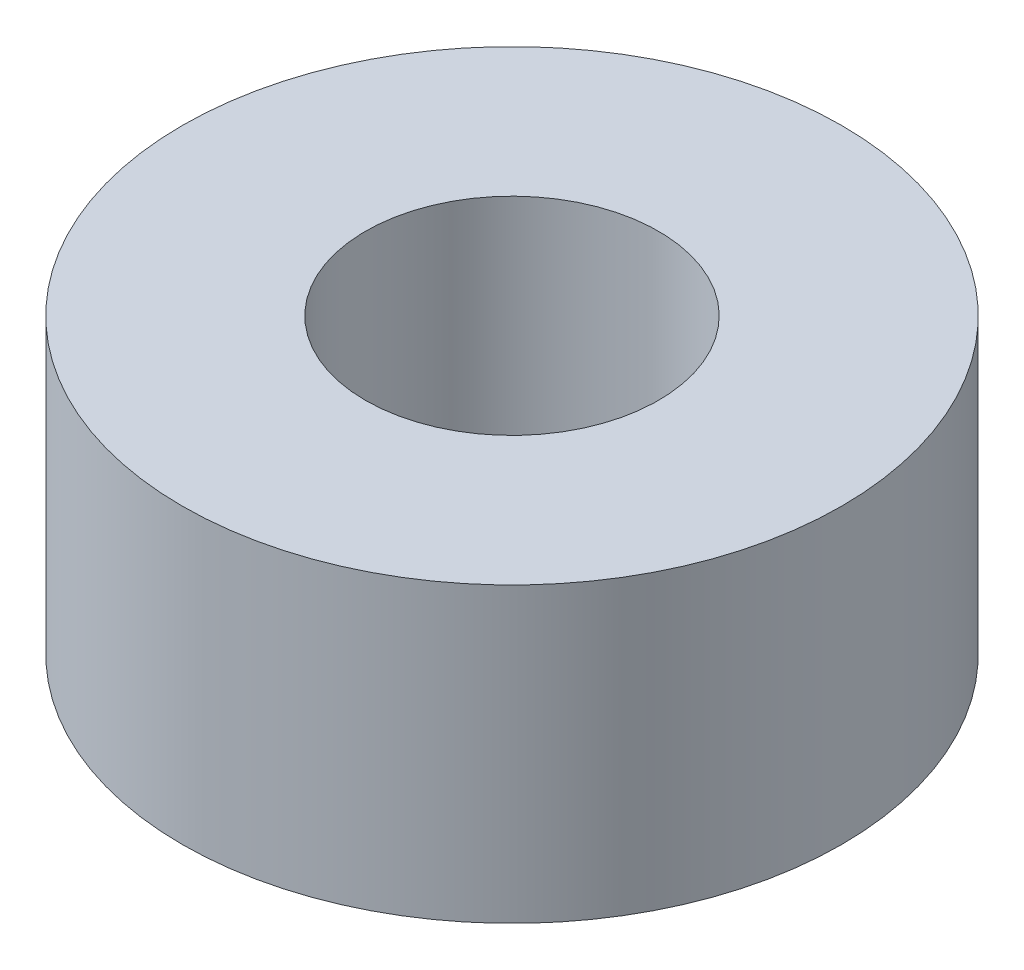
from build123d import *

# Parameters (mm, degrees)
SKETCH1_R           = 4.5
SKETCH1_R_2         = 2
BOSS_EXTRUDE1_DEPTH = 4


with BuildPart() as part:
    # Sketch1 → Boss-Extrude1 (new body)
    with BuildSketch(Plane(origin=(0, 0, 0), x_dir=(1, 0, 0), z_dir=(0, 1, 0))):
        with Locations(Location((0, 0, 0), (0, 0, 270))):
            Circle(SKETCH1_R)
        with Locations(Location((0, 0, 0), (0, 0, 270))):
            Circle(SKETCH1_R_2, mode=Mode.SUBTRACT)
    extrude(amount=BOSS_EXTRUDE1_DEPTH)


solid = part.part
